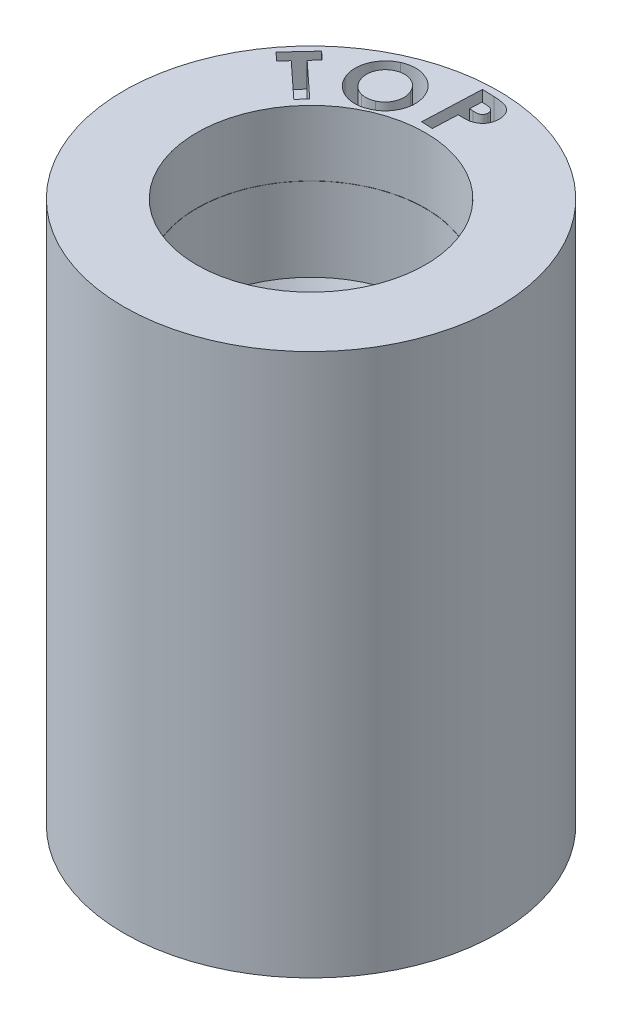
from build123d import *

# Parameters (mm, degrees)
CUT_EXTRUDE1_DEPTH = 1


with BuildPart() as part:
    # Sketch1 → Revolve1 (revolve)
    with BuildSketch(Plane.XY, mode=Mode.PRIVATE) as revolve1_sk:
        Polygon((-5.725612063, 16.59296237), (-5.725612063, 0), (-2.5, 0), (-2.5, 1), (-3.259243741, 1), (-2.85, 2.124387937), (-2.85, 3.124387937), (-3.590860823, 4.658004942), (-3, 6.281381711), (-3, 7.281381711), (-3.668649263, 8.665517367), (-3.1, 10.227868378), (-3.1, 11.227868378), (-3.493734947, 12.042918373), (-3.493734947, 14.59296237), (-3.5, 14.59296237), (-3.5, 16.59296237), (-4.725612063, 16.59296237), align=None)
    revolve(revolve1_sk.sketch.rotate(Axis((0, 31.746947892, 0), (0, -1, 0)), 270), axis=Axis((0, 31.746947892, 0), (0, -1, 0)))

    # Sketch2 → Cut-Extrude1 (cut)
    # profile 1 of 3: a face of its own
    with BuildSketch(Plane(origin=(0, 16.59296237, 0), x_dir=(1, 0, 0), z_dir=(0, 1, 0))):
        Polygon((-4.421371278, 3.349767472), (-3.751058778, 4.073445356), (-3.505145317, 3.845560741), (-3.72617897, 3.606858818), (-2.662477047, 2.621762664), (-2.896852047, 2.368998241), (-3.96055397, 3.354094395), (-4.175457817, 3.121882856), align=None)
    # profile 2 of 3: a face of its own
    with BuildSketch(Plane(origin=(0, 16.59296237, 0), x_dir=(1, 0, 0), z_dir=(0, 1, 0))):
        with BuildLine():
            add(Edge.make_bspline(
                [(-2.239121652, 4.981083147), (-2.210609451, 4.993078717), (-2.154275547, 5.016779351), (-2.066844369, 5.041951582), (-1.979003175, 5.057840228), (-1.890681021, 5.064928531), (-1.801864059, 5.062196438), (-1.712506245, 5.050553979), (-1.622626415, 5.029900521), (-1.533585549, 4.99989338), (-1.447095712, 4.962696461), (-1.365825241, 4.917739768), (-1.290776641, 4.865971602), (-1.221802085, 4.807243022), (-1.159193751, 4.741368232), (-1.103204838, 4.668329365), (-1.052909862, 4.588777247), (-1.025350617, 4.531619693), (-1.011357229, 4.502597571)],
                knots=[0, 0, 0, 0, 1.012663617, 2.000802957, 2.973158127, 3.932875131, 4.897940406, 5.878614733, 6.880558529, 7.914013375, 8.95269802, 9.960804455, 10.951427457, 11.934556996, 12.923260996, 13.922671703, 14.945222928, 16, 16, 16, 16], degree=3))
            add(Edge.make_bspline(
                [(-1.011357229, 4.502597571), (-0.99887579, 4.473127678), (-0.974358446, 4.415239843), (-0.948032135, 4.325776158), (-0.930965142, 4.236392019), (-0.92298139, 4.146885137), (-0.923929138, 4.057335573), (-0.934705734, 3.967741123), (-0.954112512, 3.878067237), (-0.983070272, 3.789594248), (-1.019379654, 3.704226892), (-1.062689905, 3.623777014), (-1.113548406, 3.550181438), (-1.170336002, 3.482009817), (-1.234452987, 3.420639592), (-1.305327105, 3.365587584), (-1.382748827, 3.316391576), (-1.43846574, 3.289548971), (-1.466765883, 3.275914878)],
                knots=[0, 0, 0, 0, 1.053593201, 2.069577656, 3.065088599, 4.046923584, 5.024959146, 6.009640047, 7.014570536, 8.042550392, 9.071414361, 10.067106381, 11.046727494, 12.013477901, 12.985169591, 13.964094338, 14.96590786, 16, 16, 16, 16], degree=3))
            add(Edge.make_bspline(
                [(-1.466765883, 3.275914878), (-1.49694674, 3.263156921), (-1.556225518, 3.238098783), (-1.647825666, 3.211617174), (-1.738814949, 3.193976577), (-1.829721061, 3.186313884), (-1.920276587, 3.188453391), (-2.010515926, 3.200588801), (-2.100434762, 3.221947506), (-2.188865367, 3.252924228), (-2.273910271, 3.292002308), (-2.354087171, 3.337466745), (-2.428043185, 3.389464141), (-2.495337919, 3.448417101), (-2.557077525, 3.513029935), (-2.612023847, 3.584538532), (-2.660678326, 3.662411507), (-2.687691869, 3.717958275), (-2.701381268, 3.746107186)],
                knots=[0, 0, 0, 0, 1.067765873, 2.097218616, 3.102723458, 4.086081422, 5.066270525, 6.050791751, 7.04998935, 8.075142485, 9.101194416, 10.098329527, 11.077075559, 12.043881751, 13.011490103, 13.986784534, 14.979781817, 16, 16, 16, 16], degree=3))
            add(Edge.make_bspline(
                [(-2.701381268, 3.746107186), (-2.709684445, 3.765479303), (-2.72615075, 3.803896789), (-2.746311641, 3.862956516), (-2.762473651, 3.92234537), (-2.7749969, 3.982150343), (-2.782777868, 4.04243268), (-2.786792546, 4.103131805), (-2.786769996, 4.164201679), (-2.782790777, 4.225382023), (-2.774986689, 4.286117888), (-2.762880564, 4.345794146), (-2.747628418, 4.404207154), (-2.727867366, 4.461071392), (-2.704734822, 4.516689069), (-2.678233273, 4.571201657), (-2.647246881, 4.624057051), (-2.612837994, 4.675382464), (-2.575142839, 4.724414306), (-2.535092955, 4.770928902), (-2.49207762, 4.813830651), (-2.4464492, 4.853577344), (-2.398504159, 4.890468945), (-2.347875571, 4.924024948), (-2.294742701, 4.95449744), (-2.257749681, 4.972179336), (-2.239121652, 4.981083147)],
                knots=[0, 0, 0, 0, 1.03476211, 2.05207095, 3.061558519, 4.055937388, 5.0501761, 6.043924107, 7.041451302, 8.046979437, 9.052923265, 10.046127708, 11.035448416, 12.015428023, 12.99978846, 13.992343744, 14.989521616, 16.006145284, 17.024976978, 18.025015698, 19.018360445, 20.005618872, 20.99493958, 21.987003326, 22.986345034, 24, 24, 24, 24], degree=3))
        make_face()
        with BuildLine():
            add(Edge.make_bspline(
                [(-2.106068768, 4.676756224), (-2.124288385, 4.667974737), (-2.160183725, 4.65067391), (-2.209940043, 4.619034502), (-2.255466863, 4.583922781), (-2.296407584, 4.544740389), (-2.333068976, 4.501714831), (-2.364874577, 4.454429605), (-2.39236849, 4.403493134), (-2.414826018, 4.349185578), (-2.43265741, 4.292919746), (-2.444084037, 4.235347971), (-2.450043191, 4.177267722), (-2.449637387, 4.11863824), (-2.442960312, 4.059608119), (-2.43066256, 4.000188849), (-2.412154412, 3.9403512), (-2.395709807, 3.901266782), (-2.387318768, 3.881323532)],
                knots=[0, 0, 0, 0, 1.028367016, 2.026035078, 2.99365383, 3.94958704, 4.904130313, 5.864182304, 6.84376722, 7.844373762, 8.850199598, 9.842077707, 10.825454198, 11.816200456, 12.819103105, 13.843388705, 14.899565591, 16, 16, 16, 16], degree=3))
            add(Edge.make_bspline(
                [(-2.387318768, 3.881323532), (-2.376814862, 3.859691884), (-2.356268599, 3.817379092), (-2.318717, 3.759135121), (-2.27733701, 3.706628917), (-2.230735479, 3.661158707), (-2.180350903, 3.621073261), (-2.124746537, 3.588576855), (-2.065184828, 3.561191581), (-2.02296119, 3.548719852), (-2.00150146, 3.542381224)],
                knots=[0, 0, 0, 0, 1.083927129, 2.120225973, 3.119421342, 4.093271994, 5.051020303, 6.016229157, 6.991768847, 8, 8, 8, 8], degree=3))
            add(Edge.make_bspline(
                [(-2.00150146, 3.542381224), (-1.984498337, 3.538209544), (-1.950876001, 3.529960376), (-1.899760107, 3.523372155), (-1.84911599, 3.520718388), (-1.798811225, 3.52258081), (-1.748808405, 3.528591631), (-1.699303208, 3.539680878), (-1.649929663, 3.554589766), (-1.618091281, 3.568271347), (-1.601982229, 3.575193724)],
                knots=[0, 0, 0, 0, 1.026431815, 2.02968797, 3.018139434, 3.998940014, 4.979411004, 5.968365394, 6.972067518, 8, 8, 8, 8], degree=3))
            add(Edge.make_bspline(
                [(-1.601982229, 3.575193724), (-1.584127479, 3.583864458), (-1.549104142, 3.600872706), (-1.500327092, 3.631998428), (-1.455695174, 3.666966307), (-1.415686274, 3.706492886), (-1.37967756, 3.749631674), (-1.348090684, 3.796864614), (-1.321092729, 3.848295545), (-1.298575187, 3.903118484), (-1.28101403, 3.95995219), (-1.26895188, 4.017653272), (-1.262827566, 4.075513067), (-1.262365175, 4.133504778), (-1.268188878, 4.191654385), (-1.280455523, 4.249709392), (-1.297425397, 4.308234658), (-1.31359572, 4.346016106), (-1.32181396, 4.365217763)],
                knots=[0, 0, 0, 0, 1.019611736, 2.000039488, 2.96786862, 3.929048647, 4.885451012, 5.851918435, 6.844111896, 7.866415681, 8.894379529, 9.897687296, 10.891802571, 11.880372906, 12.873854394, 13.889264312, 14.92726128, 16, 16, 16, 16], degree=3))
            add(Edge.make_bspline(
                [(-1.32181396, 4.365217763), (-1.330853787, 4.384024101), (-1.348596761, 4.420936353), (-1.380623387, 4.472601815), (-1.41685872, 4.519487405), (-1.456527459, 4.562434071), (-1.500523674, 4.60031571), (-1.548059331, 4.634263841), (-1.59980984, 4.663290482), (-1.654529612, 4.688074767), (-1.711189998, 4.707419377), (-1.768284972, 4.721159353), (-1.825144577, 4.72945808), (-1.88187024, 4.730679414), (-1.938403622, 4.726355935), (-1.9948448, 4.716219488), (-2.051223135, 4.70001135), (-2.087582397, 4.68459464), (-2.106068768, 4.676756224)],
                knots=[0, 0, 0, 0, 1.065225509, 2.090777659, 3.09763869, 4.087969789, 5.071465538, 6.057716397, 7.066633965, 8.096988806, 9.12202636, 10.119637174, 11.092867331, 12.050856745, 13.01136057, 13.984338994, 14.975164679, 16, 16, 16, 16], degree=3))
        make_face(mode=Mode.SUBTRACT)
    # profile 3 of 3: a face of its own
    with BuildSketch(Plane(origin=(0, 16.59296237, 0), x_dir=(1, 0, 0), z_dir=(0, 1, 0))):
        with BuildLine():
            Line((-0.275434529, 5.520588915), (0.085863548, 5.506165838))
            add(Edge.make_bspline(
                [(0.085863548, 5.506165838), (0.109432546, 5.505139179), (0.154932719, 5.503157204), (0.220422282, 5.49746825), (0.280857175, 5.491337958), (0.336047882, 5.482964139), (0.38614349, 5.473425865), (0.431056766, 5.462269501), (0.470791774, 5.449890811), (0.50584065, 5.435533523), (0.537395339, 5.419406024), (0.566584552, 5.40128534), (0.594214488, 5.381464383), (0.619759794, 5.359356976), (0.643754454, 5.335492719), (0.66580775, 5.30942114), (0.685910709, 5.281237514), (0.704423629, 5.251338291), (0.720431664, 5.219633131), (0.734801767, 5.186651255), (0.746144408, 5.152087016), (0.755336427, 5.116086164), (0.761578888, 5.078672161), (0.766072287, 5.03980926), (0.767777336, 4.999567155), (0.767256892, 4.972271269), (0.766993356, 4.958449492)],
                knots=[0, 0, 0, 0, 1.687652043, 3.258028328, 4.702426582, 6.032900152, 7.250541841, 8.349670356, 9.342319858, 10.225412373, 11.056122846, 11.874682595, 12.681412824, 13.486353631, 14.288994471, 15.100477203, 15.926187652, 16.763900983, 17.613839235, 18.465211836, 19.33539825, 20.213452159, 21.121073953, 22.046965754, 23.011044888, 24, 24, 24, 24], degree=3))
            add(Edge.make_bspline(
                [(0.766993356, 4.958449492), (0.766168828, 4.943160507), (0.764552069, 4.913181397), (0.757786022, 4.869345077), (0.748598483, 4.827599316), (0.736277287, 4.787870575), (0.720762912, 4.750366402), (0.70221009, 4.714834986), (0.68109926, 4.681236181), (0.656688837, 4.650186345), (0.630083698, 4.621311352), (0.601001198, 4.594938667), (0.570168002, 4.570732095), (0.536893618, 4.549302003), (0.501694506, 4.530242601), (0.464253125, 4.513713445), (0.425014611, 4.498958663), (0.397598172, 4.49185713), (0.383700087, 4.488257184)],
                knots=[0, 0, 0, 0, 1.119700696, 2.195543455, 3.241015091, 4.245166665, 5.234888241, 6.206469955, 7.175061873, 8.133822153, 9.092219351, 10.044666604, 11.003426884, 11.95721307, 12.937038752, 13.929101943, 14.950209511, 16, 16, 16, 16], degree=3))
            add(Edge.make_bspline(
                [(0.383700087, 4.488257184), (0.374586223, 4.486335262), (0.354790185, 4.482160694), (0.322236909, 4.478126344), (0.28483095, 4.474940418), (0.242375748, 4.472813168), (0.194883061, 4.471944159), (0.142349793, 4.47137584), (0.084767603, 4.472657917), (0.04475563, 4.474140829), (0.023844317, 4.474915838)],
                knots=[0, 0, 0, 0, 0.619125779, 1.344790593, 2.179087339, 3.115405076, 4.170649678, 5.337540212, 6.608528325, 8, 8, 8, 8], degree=3))
            Line((0.023844317, 4.474915838), (-0.006804721, 3.716622569))
            Line((-0.006804721, 3.716622569), (-0.347549913, 3.730324492))
            Line((-0.347549913, 3.730324492), (-0.275434529, 5.520588915))
        make_face()
        with BuildLine():
            Line((0.037185664, 4.807007184), (0.145358741, 4.802680261))
            add(Edge.make_bspline(
                [(0.145358741, 4.802680261), (0.165069114, 4.8021212), (0.201249122, 4.801094997), (0.250729315, 4.802434948), (0.290624649, 4.805797107), (0.322257654, 4.812594836), (0.347571102, 4.822958043), (0.369627062, 4.835443246), (0.388487135, 4.851837887), (0.405338734, 4.870441916), (0.418555271, 4.892330351), (0.428864467, 4.916419124), (0.435436449, 4.94309912), (0.436748199, 4.961777949), (0.437426048, 4.971430261)],
                knots=[0, 0, 0, 0, 1.833061305, 3.364734426, 4.600152252, 5.55169761, 6.358955928, 7.1352194, 7.896455686, 8.672316845, 9.460078776, 10.261280825, 11.101514308, 12, 12, 12, 12], degree=3))
            add(Edge.make_bspline(
                [(0.437426048, 4.971430261), (0.437492275, 4.979731131), (0.437621352, 4.995909838), (0.434708408, 5.019401602), (0.429290777, 5.041334544), (0.421361226, 5.061611356), (0.41089267, 5.08037575), (0.397196457, 5.096864219), (0.381634863, 5.112472177), (0.369424647, 5.121008145), (0.363147202, 5.125396607)],
                knots=[0, 0, 0, 0, 1.108724409, 2.16094534, 3.154620957, 4.121301992, 5.063916992, 6.012401637, 6.978147584, 8, 8, 8, 8], degree=3))
            add(Edge.make_bspline(
                [(0.363147202, 5.125396607), (0.357933352, 5.128550337), (0.346807296, 5.135280216), (0.327442187, 5.142766834), (0.305429587, 5.150268422), (0.279961552, 5.155673733), (0.251464049, 5.160709999), (0.219739727, 5.165175082), (0.184807863, 5.167769967), (0.160504856, 5.169071566), (0.147882779, 5.169747569)],
                knots=[0, 0, 0, 0, 0.657719068, 1.403534747, 2.237863, 3.171100321, 4.213843597, 5.368144657, 6.633112287, 8, 8, 8, 8], degree=3))
            Line((0.147882779, 5.169747569), (0.051969317, 5.173353338))
            Line((0.051969317, 5.173353338), (0.037185664, 4.807007184))
        make_face(mode=Mode.SUBTRACT)
    extrude(amount=-CUT_EXTRUDE1_DEPTH, mode=Mode.SUBTRACT)


solid = part.part
